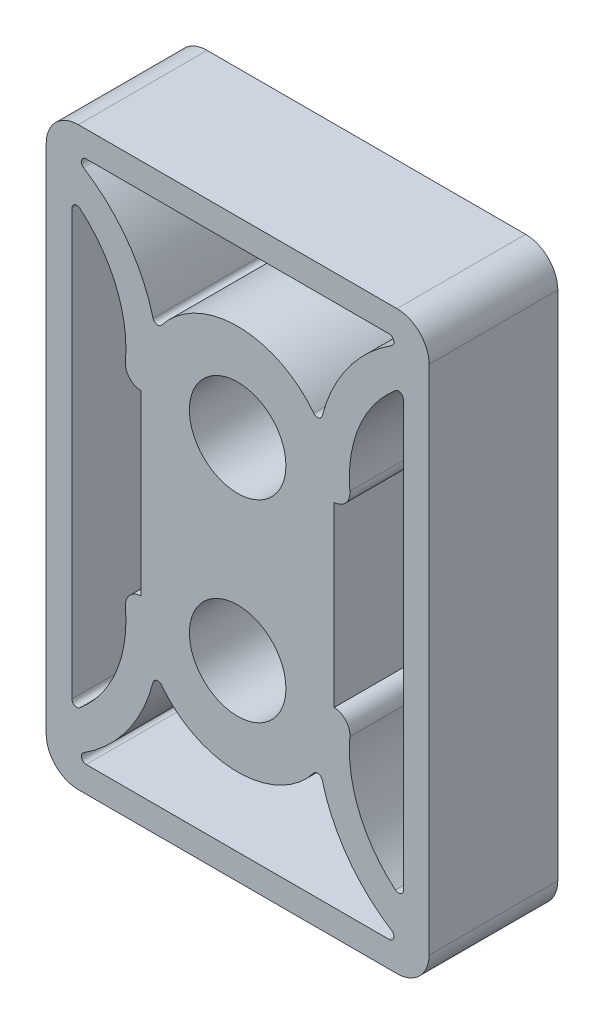
from build123d import *

# Parameters (mm, degrees)
SKETCH1_R           = 1.5
BOSS_EXTRUDE1_DEPTH = 4
SKETCH3_W           = 11.9
SKETCH3_H           = 17.9
BOSS_EXTRUDE2_DEPTH = 4
FILLET1_R           = 1
FILLET2_R           = 0.15


with BuildPart() as part:
    # Sketch1 → Boss-Extrude1 (new body)
    with BuildSketch(Plane.XY):
        with BuildLine():
            Line((3, 3), (3, -3))
            ThreePointArc((3, -3), (0, -6), (-3, -3))
            Line((-3, -3), (-3, 3))
            ThreePointArc((-3, 3), (0, 6), (3, 3))
        make_face()
        with Locations((0, 3)):
            Circle(SKETCH1_R, mode=Mode.SUBTRACT)
        with Locations((0, -3)):
            Circle(SKETCH1_R, mode=Mode.SUBTRACT)
    extrude(amount=BOSS_EXTRUDE1_DEPTH)

    # Sketch3 → Boss-Extrude2 (add)
    with BuildSketch(Plane.XY):
        Rectangle(SKETCH3_W, SKETCH3_H)
        with BuildLine():
            Line((3, 2.761547355), (3, 3))
            ThreePointArc((3, 3), (2.886925552, 3.815880419), (2.556226094, 4.570257353))
            ThreePointArc((2.556226094, 4.570257353), (3.494887171, 6.684512846), (5.284721888, 8.15))
            Line((5.284721888, 8.15), (-5.284721888, 8.15))
            ThreePointArc((-5.284721888, 8.15), (-3.494887171, 6.684512846), (-2.556226094, 4.570257353))
            ThreePointArc((-2.556226094, 4.570257353), (-2.886925552, 3.815880419), (-3, 3))
            Line((-3, 3), (-3, 2.761547355))
            ThreePointArc((-3, 2.761547355), (-3.361055351, 2.927847888), (-3.486686558, 3.304986634))
            ThreePointArc((-3.486686558, 3.304986634), (-3.839257283, 5.328959778), (-5.15, 6.910960705))
            Line((-5.15, 6.910960705), (-5.15, -6.910960705))
            ThreePointArc((-5.15, -6.910960705), (-3.839257283, -5.328959778), (-3.486686558, -3.304986634))
            ThreePointArc((-3.486686558, -3.304986634), (-3.361055351, -2.927847888), (-3, -2.761547355))
            Line((-3, -2.761547355), (-3, -3))
            ThreePointArc((-3, -3), (-2.886925552, -3.815880419), (-2.556226094, -4.570257353))
            ThreePointArc((-2.556226094, -4.570257353), (-3.494887171, -6.684512846), (-5.284721888, -8.15))
            Line((-5.284721888, -8.15), (5.284721888, -8.15))
            ThreePointArc((5.284721888, -8.15), (3.494887171, -6.684512846), (2.556226094, -4.570257353))
            ThreePointArc((2.556226094, -4.570257353), (2.886925552, -3.815880419), (3, -3))
            Line((3, -3), (3, -2.761547355))
            ThreePointArc((3, -2.761547355), (3.361055351, -2.927847888), (3.486686558, -3.304986634))
            ThreePointArc((3.486686558, -3.304986634), (3.839257283, -5.328959778), (5.15, -6.910960705))
            Line((5.15, -6.910960705), (5.15, 6.910960705))
            ThreePointArc((5.15, 6.910960705), (3.839257283, 5.328959778), (3.486686558, 3.304986634))
            ThreePointArc((3.486686558, 3.304986634), (3.361055351, 2.927847888), (3, 2.761547355))
        make_face(mode=Mode.SUBTRACT)
    extrude(amount=BOSS_EXTRUDE2_DEPTH)

    # Fillet1
    fillet1_edges = [part.edges().sort_by_distance(p)[0] for p in [
        (5.95, 8.95, 2),
        (-5.95, 8.95, 2),
        (-5.95, -8.95, 2),
        (5.95, -8.95, 2),
    ]]
    fillet(fillet1_edges, radius=FILLET1_R)

    # Fillet2
    fillet2_edges = [part.edges().sort_by_distance(p)[0] for p in [
        (-5.15, 6.910960705, 2),
        (-5.15, -6.910960705, 2),
        (-2.556226094, -4.570257353, 2),
        (-5.284721888, -8.15, 2),
        (5.284721888, -8.15, 2),
        (2.556226094, -4.570257353, 2),
        (5.15, -6.910960705, 2),
        (5.15, 6.910960705, 2),
        (2.556226094, 4.570257353, 2),
        (5.284721888, 8.15, 2),
        (-5.284721888, 8.15, 2),
        (-2.556226094, 4.570257353, 2),
    ]]
    fillet(fillet2_edges, radius=FILLET2_R)


solid = part.part
